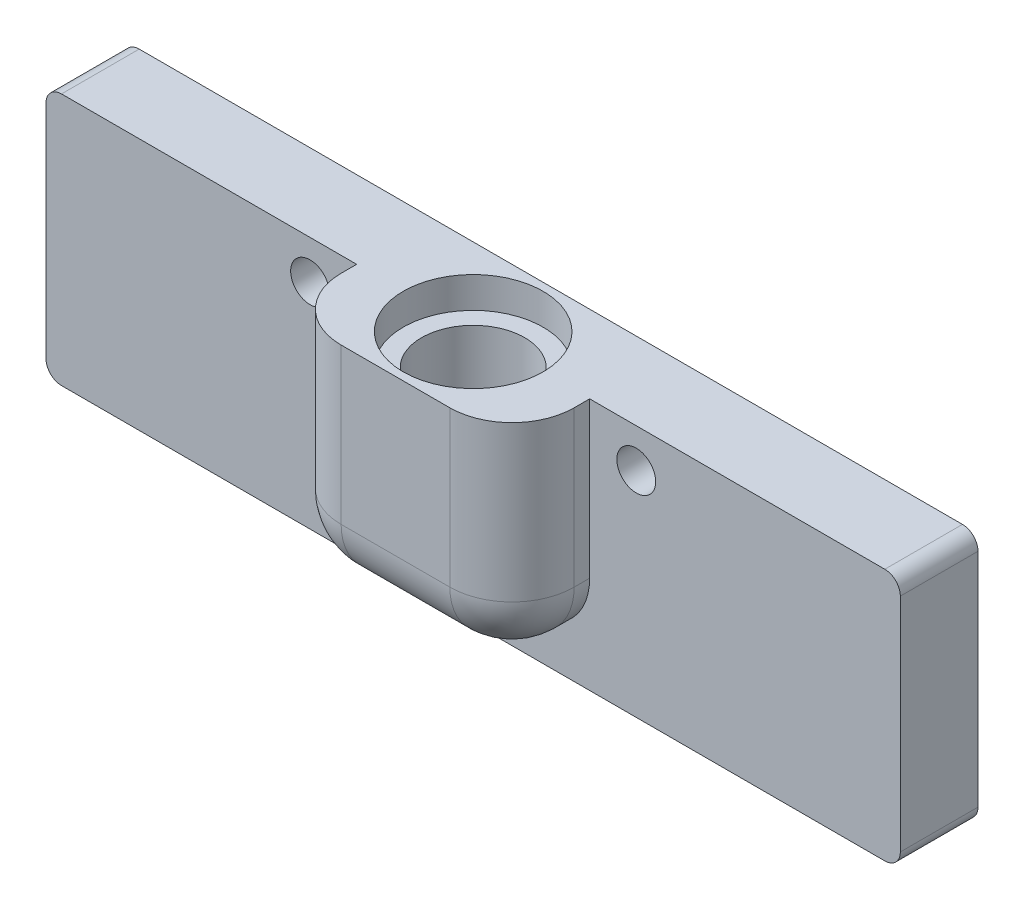
from build123d import *

# Parameters (mm, degrees)
SKETCH1_W                               = 55.000000074
SKETCH1_H                               = 16.2630756
BOSS_EXTRUDE1_DEPTH                     = 5
SKETCH4_W                               = 15
SKETCH4_H                               = 14
BOSS_EXTRUDE2_DEPTH                     = 5
CBORE_FOR_M6_HEX_HEAD_BOLT1_D           = 6.647
CBORE_FOR_M6_HEX_HEAD_BOLT1_DEPTH       = 10
CBORE_FOR_M6_HEX_HEAD_BOLT1_CBORE_D     = 9
CBORE_FOR_M6_HEX_HEAD_BOLT1_CBORE_DEPTH = 2
CBORE_FOR_M6_HEX_HEAD_BOLT1_TIP         = 1.996960267
FILLET1_R                               = 1
FILLET2_R                               = 4
TAP_DRILL_FOR_M3X0_5_TAP1_D             = 2.5


with BuildPart() as part:
    # Sketch1 → Boss-Extrude1 (new body)
    with BuildSketch(Plane(origin=(0, 0, 0), x_dir=(-1, 0, 0), z_dir=(0, 0, -1))):
        with Locations((3.7e-08, -8.131537807)):
            Rectangle(SKETCH1_W, SKETCH1_H)
    extrude(amount=-BOSS_EXTRUDE1_DEPTH)

    # Sketch4 → Boss-Extrude2 (add)
    with BuildSketch(Plane.XY.offset(5)):
        with Locations((0, -7)):
            Rectangle(SKETCH4_W, SKETCH4_H)
    extrude(amount=BOSS_EXTRUDE2_DEPTH)

    # CBORE for M6 Hex Head Bolt1
    with Locations(Plane(origin=(0, 0, 0), x_dir=(1, 0, 0), z_dir=(0, 1, 0))):
        with Locations((0, -5)):
            CounterBoreHole(CBORE_FOR_M6_HEX_HEAD_BOLT1_D / 2, CBORE_FOR_M6_HEX_HEAD_BOLT1_CBORE_D / 2, CBORE_FOR_M6_HEX_HEAD_BOLT1_CBORE_DEPTH, depth=CBORE_FOR_M6_HEX_HEAD_BOLT1_DEPTH)
            with Locations((0, 0, -(CBORE_FOR_M6_HEX_HEAD_BOLT1_DEPTH + CBORE_FOR_M6_HEX_HEAD_BOLT1_TIP / 2))):  # 118° drill point
                Cone(0, CBORE_FOR_M6_HEX_HEAD_BOLT1_D / 2, CBORE_FOR_M6_HEX_HEAD_BOLT1_TIP, mode=Mode.SUBTRACT)

    # Fillet1
    fillet1_edges = [part.edges().sort_by_distance(p)[0] for p in [
        (27.5, -7e-09, 2.5),
        (-27.500000074, -7e-09, 2.5),
        (27.5, -16.263075607, 2.5),
        (-27.500000074, -16.263075607, 2.5),
    ]]
    fillet(fillet1_edges, radius=FILLET1_R)

    # Fillet2
    fillet2_edges = [part.edges().sort_by_distance(p)[0] for p in [
        (7.5, -14, 7.5),
        (7.5, -7, 10),
        (-7.5, -14, 7.5),
        (0, -14, 10),
        (-7.5, -7, 10),
    ]]
    fillet(fillet2_edges, radius=FILLET2_R)

    # Tap Drill for M3x0.5 Tap1 (through all)
    with Locations(Plane(origin=(-10.5, -2.500000007, 5), x_dir=(1, 0, 0), z_dir=(0, 0, 1))):
        with Locations((0, 0), (21, 0)):
            Hole(TAP_DRILL_FOR_M3X0_5_TAP1_D / 2)


solid = part.part
